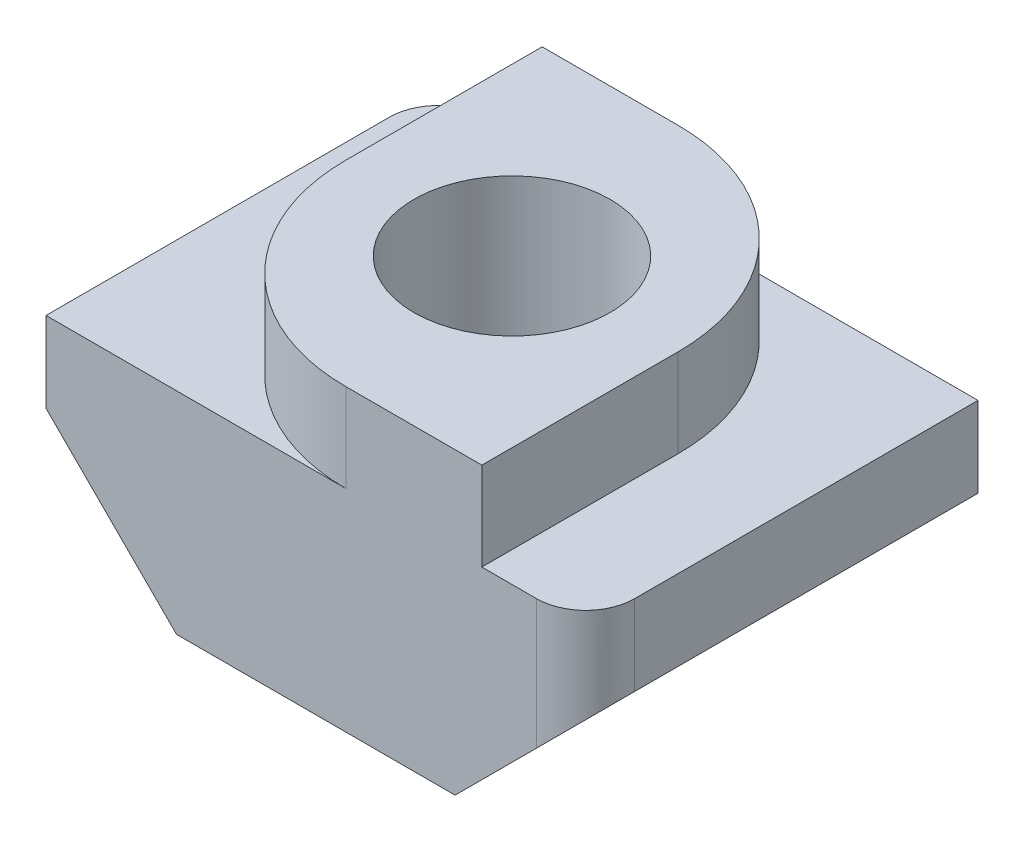
from build123d import *

# Parameters (mm, degrees)
SKETCH1_W           = 11
SKETCH1_H           = 8
SKETCH1_R           = 2
BOSS_EXTRUDE1_DEPTH = 4.3
CUT_EXTRUDE1_DEPTH  = 11.617909399
SKETCH3_W           = 6.77
SKETCH3_H           = 8
SKETCH3_R           = 2
BOSS_EXTRUDE2_DEPTH = 1.8
FILLET1_R           = 4
FILLET2_R           = 1


with BuildPart() as part:
    # Sketch1 → Boss-Extrude1 (new body)
    with BuildSketch(Plane(origin=(0, 0, 0), x_dir=(1, 0, 0), z_dir=(0, 1, 0))):
        Rectangle(SKETCH1_W, SKETCH1_H)
        with Locations(Location((0, 0, 0), (0, 0, 90))):
            Circle(SKETCH1_R, mode=Mode.SUBTRACT)
    extrude(amount=BOSS_EXTRUDE1_DEPTH)

    # Sketch2 → Cut-Extrude1 (cut, through all)
    with BuildSketch(Plane.XY.offset(4)):
        Polygon((-5.5, 2.66), (-2.84, 0), (-5.5, 0), align=None)
        Polygon((5.5, 2.66), (5.5, 0), (2.84, 0), align=None)
    extrude(amount=-CUT_EXTRUDE1_DEPTH, mode=Mode.SUBTRACT)

    # Sketch3 → Boss-Extrude2 (add)
    with BuildSketch(Plane(origin=(0, 4.3, 0), x_dir=(1, 0, 0), z_dir=(0, 1, 0))):
        Rectangle(SKETCH3_W, SKETCH3_H)
        with Locations(Location((0, 0, 0), (0, 0, 90))):
            Circle(SKETCH3_R, mode=Mode.SUBTRACT)
    extrude(amount=BOSS_EXTRUDE2_DEPTH)

    # Fillet1
    fillet1_edges = [part.edges().sort_by_distance(p)[0] for p in [
        (3.385, 5.2, -4),
        (-3.385, 5.2, 4),
    ]]
    fillet(fillet1_edges, radius=FILLET1_R)

    # Fillet2
    fillet2_edges = [part.edges().sort_by_distance(p)[0] for p in [
        (5.5, 3.48, 4),
        (-5.5, 3.48, -4),
    ]]
    fillet(fillet2_edges, radius=FILLET2_R)


solid = part.part
